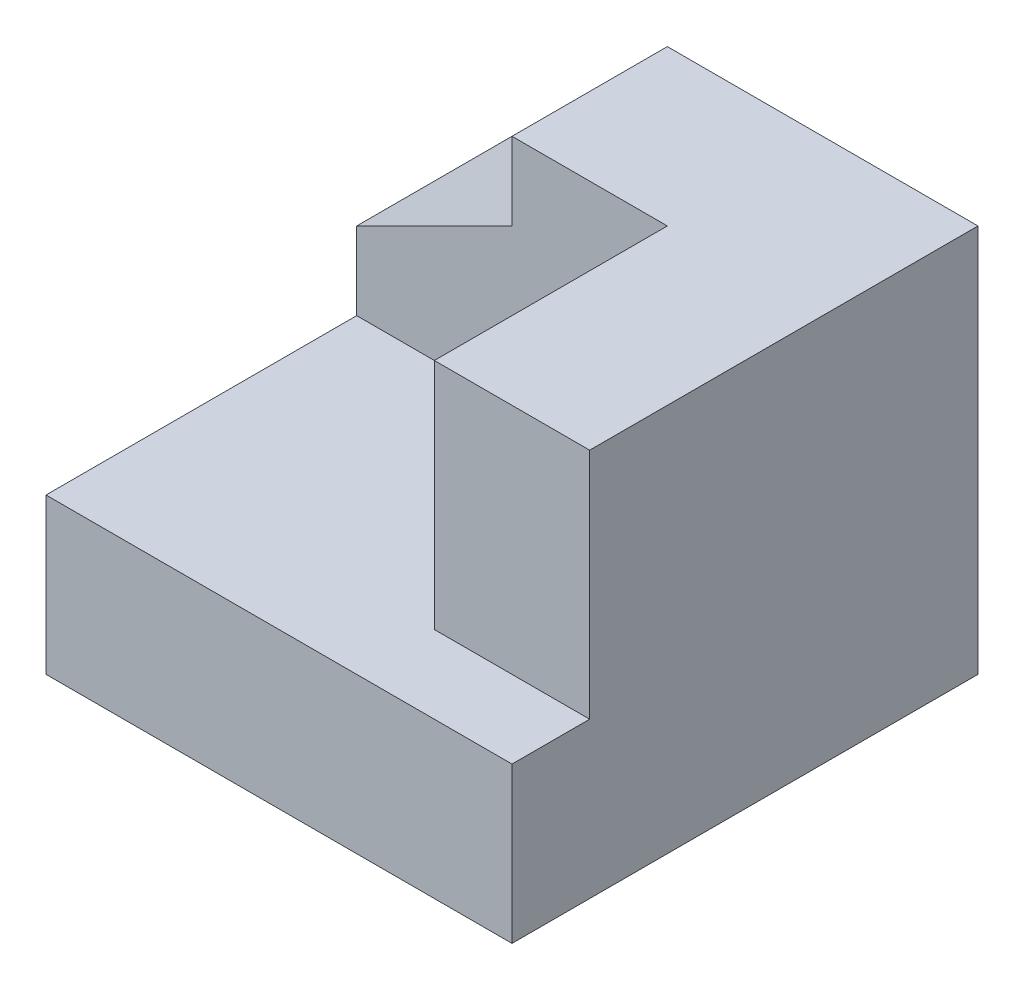
from build123d import *

# Parameters (mm, degrees)
BOSS_EXTRUDE1_DEPTH      = 120
SKETCH1_3_W              = 80
SKETCH1_3_H              = 120
BOSS_EXTRUDE2_DEPTH      = 80
BOSS_EXTRUDE3_DEPTH      = 120
SKETCH1_5_W              = 80
SKETCH1_5_H              = 120
BOSS_EXTRUDE4_DEPTH      = 120
SKETCH2_W                = 80
SKETCH2_H                = 40
BOSS_EXTRUDE5_DEPTH      = 160
SKETCH2_8_W              = 80
SKETCH2_8_H              = 40
BOSS_EXTRUDE6_DEPTH      = 80
SKETCH2_9_W              = 80
SKETCH2_9_H              = 40
BOSS_EXTRUDE7_DEPTH      = 160
CUT_EXTRUDE20_DEPTH      = 224.60679775
CUT_EXTRUDE20_DEPTH_BACK = 121


with BuildPart() as part:
    # Sketch1 → Boss-Extrude1 (new body)
    with BuildSketch(Plane.XY):
        Polygon((120, -100), (120, -20), (40, -20), (-120, -20), (-120, -100), align=None)
    extrude(amount=BOSS_EXTRUDE1_DEPTH)

    # Sketch1<3> → Boss-Extrude2 (add)
    with BuildSketch(Plane.XY):
        with Locations((80, 40)):
            Rectangle(SKETCH1_3_W, SKETCH1_3_H)
    extrude(amount=BOSS_EXTRUDE2_DEPTH)

    # Sketch1<4> → Boss-Extrude3 (add)
    with BuildSketch(Plane.XY):
        Polygon((120, -100), (120, -20), (40, -20), (-120, -20), (-120, -100), align=None)
    extrude(amount=-BOSS_EXTRUDE3_DEPTH)

    # Sketch1<5> → Boss-Extrude4 (add)
    with BuildSketch(Plane.XY):
        with Locations((80, 40)):
            Rectangle(SKETCH1_5_W, SKETCH1_5_H)
    extrude(amount=-BOSS_EXTRUDE4_DEPTH)

    # Sketch2 → Boss-Extrude5 (add)
    with BuildSketch(Plane.ZY.offset(-40)):
        with Locations((-80, 0)):
            Rectangle(SKETCH2_W, SKETCH2_H)
    extrude(amount=BOSS_EXTRUDE5_DEPTH)

    # Sketch2<8> → Boss-Extrude6 (add)
    with BuildSketch(Plane.ZY.offset(-40)):
        with Locations((-80, 80)):
            Rectangle(SKETCH2_8_W, SKETCH2_8_H)
    extrude(amount=BOSS_EXTRUDE6_DEPTH)

    # Sketch2<9> → Boss-Extrude7 (add)
    with BuildSketch(Plane.ZY.offset(-40)):
        with Locations((-80, 40)):
            Rectangle(SKETCH2_9_W, SKETCH2_9_H)
    extrude(amount=BOSS_EXTRUDE7_DEPTH)

    # Sketch4 → Cut-Extrude20 (cut, two sides: drawn at the far end of the back side and taken through both)
    with BuildSketch(Plane.XY.offset(-40).offset(-CUT_EXTRUDE20_DEPTH_BACK)):
        Polygon((-120, 20), (-40, 60), (-120, 60), align=None)
    extrude(amount=CUT_EXTRUDE20_DEPTH + CUT_EXTRUDE20_DEPTH_BACK, mode=Mode.SUBTRACT)


solid = part.part
